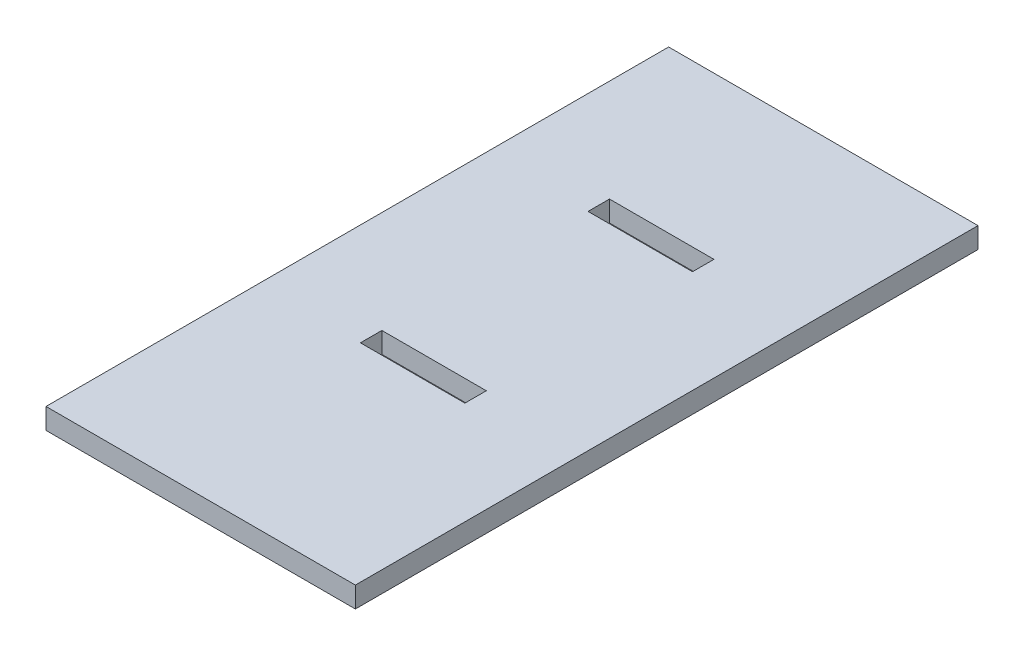
from build123d import *

# Parameters (mm, degrees)
SKETCH2_W           = 44.72
SKETCH2_H           = 90
SKETCH2_W_2         = 15.1
SKETCH2_H_2         = 3.1
BOSS_EXTRUDE3_DEPTH = 3


with BuildPart() as part:
    # Sketch2 → Boss-Extrude3 (new body)
    with BuildSketch(Plane(origin=(0, 0, 0), x_dir=(1, 0, 0), z_dir=(0, 1, 0))):
        with Locations((22.36, 45)):
            Rectangle(SKETCH2_W, SKETCH2_H)
        with Locations((22.31, 32.24)):
            Rectangle(SKETCH2_W_2, SKETCH2_H_2, mode=Mode.SUBTRACT)
        with Locations((22.31, 65.14)):
            Rectangle(SKETCH2_W_2, SKETCH2_H_2, mode=Mode.SUBTRACT)
    extrude(amount=BOSS_EXTRUDE3_DEPTH)


solid = part.part
